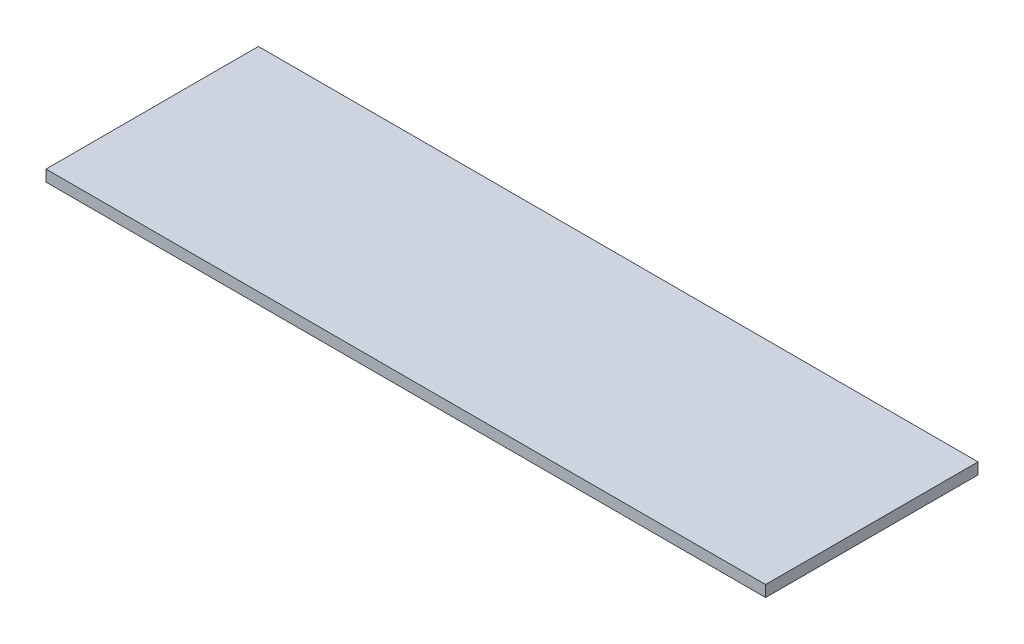
from build123d import *

# Parameters (mm, degrees)
SKETCH1_W      = 161.712369322
SKETCH1_H      = 47.734559901
EXTRUDE1_DEPTH = 2.54


with BuildPart() as part:
    # Sketch1 → Extrude1 (new body)
    with BuildSketch(Plane(origin=(0, 0, 0), x_dir=(1, 0, 0), z_dir=(0, 1, 0))):
        with Locations((14.738127986, -15.361487658)):
            Rectangle(SKETCH1_W, SKETCH1_H)
    extrude(amount=EXTRUDE1_DEPTH)


solid = part.part
